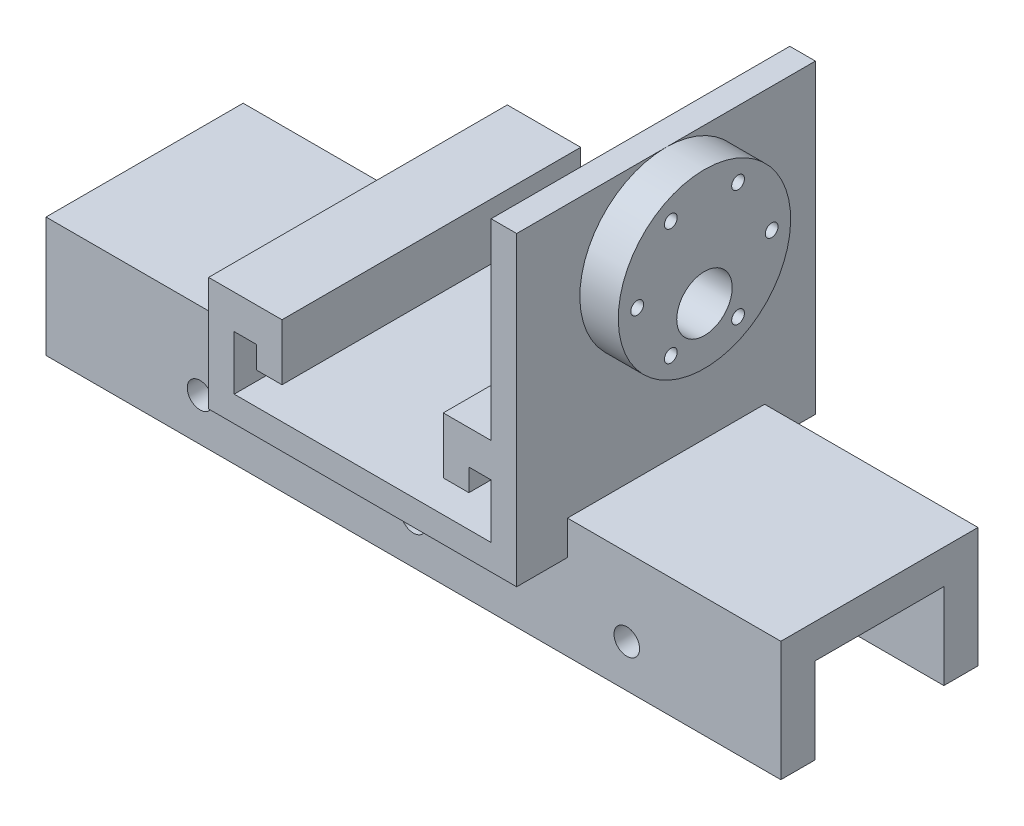
from build123d import *
from build123d.topology import SkipClean

# Parameters (mm, degrees)
BOSS_EXTRUDE1_DEPTH  = 70
SKETCH2_R            = 1.5
CUT_EXTRUDE1_DEPTH   = 6
LPATTERN1_COUNT      = 4
LPATTERN1_PITCH      = 14
LPATTERN1_COUNT_DIR2 = 2
LPATTERN1_PITCH_DIR2 = 55
SKETCH4_W            = 46.2
SKETCH4_H            = 8
BOSS_EXTRUDE2_DEPTH  = 50
SKETCH5_W            = 46.2
SKETCH5_H            = 8
BOSS_EXTRUDE3_DEPTH  = 50
SKETCH6_W            = 172.2
SKETCH6_H            = 8
BOSS_EXTRUDE4_DEPTH  = 20.1
CIRPATTERN2_COUNT    = 6
SKETCH10_R           = 6.5
CUT_EXTRUDE4_DEPTH   = 10
SKETCH11_R           = 20.2
SKETCH11_R_2         = 1.5
SKETCH11_R_3         = 6.5
BOSS_EXTRUDE6_DEPTH  = 9
SKETCH12_R           = 3
CUT_EXTRUDE5_DEPTH   = 154.13177332


with BuildPart() as part:
    # Sketch1 → Boss-Extrude1 (new body)
    with BuildSketch(Plane.XY):
        Polygon((0, 26.7), (0, 0), (72.2, 0), (72.2, 71.7), (66.2, 71.7), (66.2, 26.7), (55, 26.7), (55, 13.5), (61, 13.5), (61, 18.7), (66.2, 18.7), (66.2, 6), (6, 6), (6, 18.7), (11.2, 18.7), (11.2, 13.5), (17.2, 13.5), (17.2, 26.7), align=None)
    extrude(amount=BOSS_EXTRUDE1_DEPTH)

    # Sketch2 → Cut-Extrude1 (cut)
    with BuildSketch(Plane.ZY.offset(-66.2)):
        with Locations((50.75, 51.5)):
            Circle(SKETCH2_R)
    cut_extrude1 = extrude(amount=-CUT_EXTRUDE1_DEPTH, mode=Mode.SUBTRACT)

    # Sketch3 → Cut-Revolve1 (revolve, cut)
    with BuildSketch(Plane.XZ.offset(-18.7)):
        with BuildLine():
            Line((61.1, 56), (66.1, 56))
            ThreePointArc((66.1, 56), (63.6, 58.5), (61.1, 56))
        make_face()
    cut_revolve1 = revolve(axis=Axis((61.1, 18.7, 56), (1, 0, 0)), mode=Mode.SUBTRACT)

    # LPattern1: Cut-Revolve1 4 × 2
    with Locations(*[(-j * LPATTERN1_PITCH_DIR2, 0, -i * LPATTERN1_PITCH) for i in range(LPATTERN1_COUNT) for j in range(LPATTERN1_COUNT_DIR2) if (i, j) != (0, 0)]):
        add(cut_revolve1, mode=Mode.SUBTRACT)

    # Sketch4 → Boss-Extrude2 (add)
    with BuildSketch(Plane(origin=(72.2, 0, 0), x_dir=(0, 0, -1), z_dir=(1, 0, 0))):
        with Locations((-35, 4)):
            Rectangle(SKETCH4_W, SKETCH4_H)
    extrude(amount=BOSS_EXTRUDE2_DEPTH)

    # Sketch5 → Boss-Extrude3 (add)
    with BuildSketch(Plane.ZY):
        with Locations((35, 4)):
            Rectangle(SKETCH5_W, SKETCH5_H)
    extrude(amount=BOSS_EXTRUDE3_DEPTH)

    # Sketch6 → Boss-Extrude4 (add)
    with BuildSketch(Plane.XZ):
        with Locations((36.1, 54.1)):
            Rectangle(SKETCH6_W, SKETCH6_H)
        with Locations((36.1, 15.9)):
            Rectangle(SKETCH6_W, SKETCH6_H)
    extrude(amount=BOSS_EXTRUDE4_DEPTH)

    # CirPattern2: Cut-Extrude1 ×6 about axis
    cirpattern2_axis = Axis((66.2, 51.5, 35), (-1, 0, 0))
    for i in range(1, CIRPATTERN2_COUNT):
        add(cut_extrude1.rotate(cirpattern2_axis, i * 360 / CIRPATTERN2_COUNT), mode=Mode.SUBTRACT)

    # Sketch10 → Cut-Extrude4 (cut)
    with BuildSketch(Plane.ZY.offset(-66.2)):
        with Locations((35, 44.5)):
            Circle(SKETCH10_R)
    extrude(amount=-CUT_EXTRUDE4_DEPTH, mode=Mode.SUBTRACT)

    # Sketch11 → Boss-Extrude6 (add)
    with SkipClean():  # the faces are left unmerged after this step: merging them gives an invalid solid
        with BuildSketch(Plane(origin=(72.2, 0, 0), x_dir=(0, 0, -1), z_dir=(1, 0, 0))):
            with Locations((-35, 51.5)):
                Circle(SKETCH11_R)
            with Locations((-42.875, 65.13990011)):
                Circle(SKETCH11_R_2, mode=Mode.SUBTRACT)
            with Locations((-27.125, 65.13990011)):
                Circle(SKETCH11_R_2, mode=Mode.SUBTRACT)
            with Locations((-19.25, 51.5)):
                Circle(SKETCH11_R_2, mode=Mode.SUBTRACT)
            with Locations((-27.125, 37.86009989)):
                Circle(SKETCH11_R_2, mode=Mode.SUBTRACT)
            with Locations((-35, 44.5)):
                Circle(SKETCH11_R_3, mode=Mode.SUBTRACT)
            with Locations((-42.875, 37.86009989)):
                Circle(SKETCH11_R_2, mode=Mode.SUBTRACT)
            with Locations((-50.75, 51.5)):
                Circle(SKETCH11_R_2, mode=Mode.SUBTRACT)
        extrude(amount=BOSS_EXTRUDE6_DEPTH)
    add(part.part.scale(1), mode=Mode.REPLACE)  # the faces are merged on a copy

    # Sketch12 → Cut-Extrude5 (cut, through all)
    with BuildSketch(Plane(origin=(0, 0, 11.9), x_dir=(-1, 0, 0), z_dir=(0, 0, -1))):
        with Locations((-36.1, -10.1)):
            Circle(SKETCH12_R)
        with Locations((-86.1, -10.1)):
            Circle(SKETCH12_R)
        with Locations((13.9, -10.1)):
            Circle(SKETCH12_R)
    extrude(amount=-CUT_EXTRUDE5_DEPTH, mode=Mode.SUBTRACT)


solid = part.part
